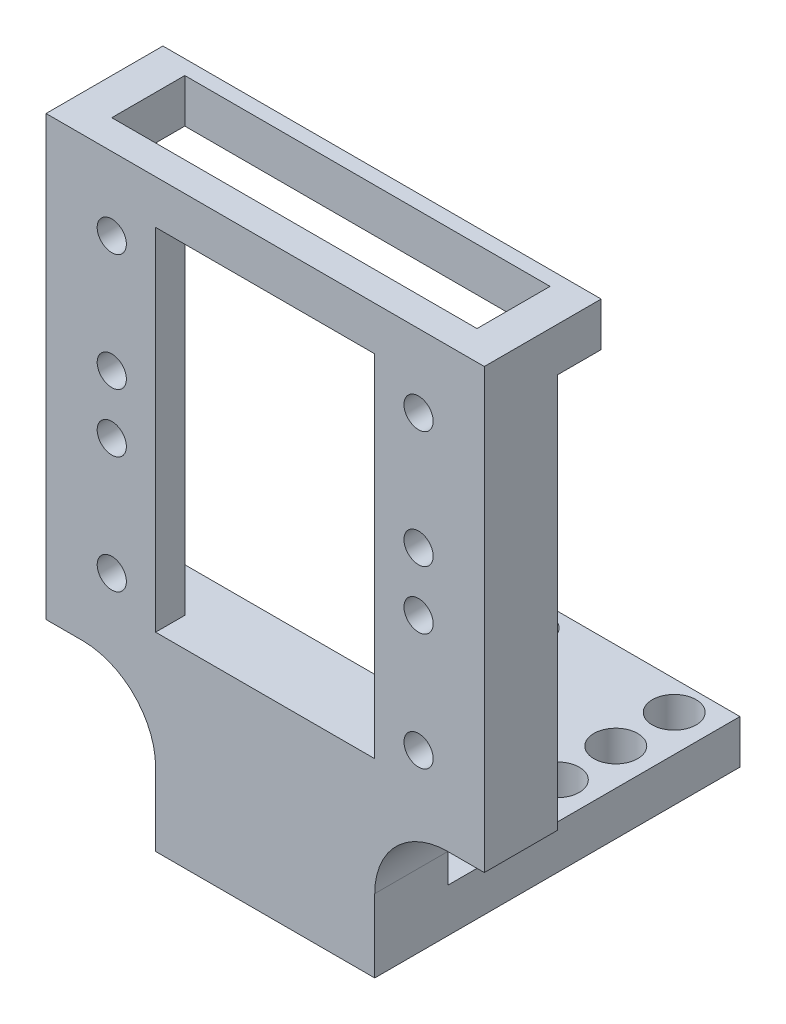
from build123d import *

# Parameters (mm, degrees)
SKETCH1_W           = 30
SKETCH1_H           = 30
BOSS_EXTRUDE1_DEPTH = 5
SKETCH2_W           = 25
SKETCH2_H           = 24
CUT_EXTRUDE1_DEPTH  = 3
SKETCH3_W           = 15
SKETCH3_H           = 24
CUT_EXTRUDE2_DEPTH  = 22.424285286
SKETCH4_R           = 1
CUT_EXTRUDE3_DEPTH  = 22.424285286
SKETCH5_W           = 30
SKETCH5_H           = 3
BOSS_EXTRUDE2_DEPTH = 3
SKETCH6_R           = 1
CUT_EXTRUDE4_DEPTH  = 23.045407685
SKETCH7_W           = 25
SKETCH7_H           = 5
CUT_EXTRUDE5_DEPTH  = 4
SKETCH8_W           = 30
SKETCH8_H           = 3
CUT_EXTRUDE7_DEPTH  = 3
SKETCH9_W           = 30
SKETCH9_H           = 5
BOSS_EXTRUDE3_DEPTH = 10
SKETCH12_W          = 15
SKETCH12_H          = 3
BOSS_EXTRUDE5_DEPTH = 20
SKETCH13_W          = 7.5
SKETCH13_H          = 10
CUT_EXTRUDE9_DEPTH  = 36.355339059
SKETCH14_R          = 1.5
CUT_EXTRUDE10_DEPTH = 45.654227124
FILLET1_R           = 5
FILLET2_R           = 5


with BuildPart() as part:
    # Sketch1 → Boss-Extrude1 (new body)
    with BuildSketch(Plane.XY):
        Rectangle(SKETCH1_W, SKETCH1_H)
    extrude(amount=BOSS_EXTRUDE1_DEPTH)

    # Sketch2 → Cut-Extrude1 (cut)
    with BuildSketch(Plane(origin=(0, 0, 0), x_dir=(-1, 0, 0), z_dir=(0, 0, -1))):
        Rectangle(SKETCH2_W, SKETCH2_H)
    extrude(amount=-CUT_EXTRUDE1_DEPTH, mode=Mode.SUBTRACT)

    # Sketch3 → Cut-Extrude2 (cut, through all)
    with BuildSketch(Plane(origin=(0, 0, 3), x_dir=(-1, 0, 0), z_dir=(0, 0, -1))):
        Rectangle(SKETCH3_W, SKETCH3_H)
    extrude(amount=-CUT_EXTRUDE2_DEPTH, mode=Mode.SUBTRACT)

    # Sketch4 → Cut-Extrude3 (cut, through all)
    with BuildSketch(Plane(origin=(0, 0, 3), x_dir=(-1, 0, 0), z_dir=(0, 0, -1))):
        with Locations((10.5, 10)):
            Circle(SKETCH4_R)
        with Locations((10.5, -10)):
            Circle(SKETCH4_R)
        with Locations((-10.5, 10)):
            Circle(SKETCH4_R)
        with Locations((-10.5, -10)):
            Circle(SKETCH4_R)
    extrude(amount=-CUT_EXTRUDE3_DEPTH, mode=Mode.SUBTRACT)

    # Sketch5 → Boss-Extrude2 (add)
    with BuildSketch(Plane(origin=(0, 0, 0), x_dir=(-1, 0, 0), z_dir=(0, 0, -1))):
        with Locations((0, 13.5)):
            Rectangle(SKETCH5_W, SKETCH5_H)
        with Locations((0, -13.5)):
            Rectangle(SKETCH5_W, SKETCH5_H)
    extrude(amount=BOSS_EXTRUDE2_DEPTH)

    # Sketch6 → Cut-Extrude4 (cut, through all)
    with BuildSketch(Plane(origin=(0, 0, 3), x_dir=(-1, 0, 0), z_dir=(0, 0, -1))):
        with Locations((-10.5, 2)):
            Circle(SKETCH6_R)
        with Locations((-10.5, -2)):
            Circle(SKETCH6_R)
        with Locations((10.5, 2)):
            Circle(SKETCH6_R)
        with Locations((10.5, -2)):
            Circle(SKETCH6_R)
    extrude(amount=-CUT_EXTRUDE4_DEPTH, mode=Mode.SUBTRACT)

    # Sketch7 → Cut-Extrude5 (cut)
    with BuildSketch(Plane(origin=(0, 15, 0), x_dir=(1, 0, 0), z_dir=(0, 1, 0))):
        with Locations((0, -0.5)):
            Rectangle(SKETCH7_W, SKETCH7_H)
    extrude(amount=-CUT_EXTRUDE5_DEPTH, mode=Mode.SUBTRACT)

    # Sketch8 → Cut-Extrude7 (cut)
    with BuildSketch(Plane(origin=(0, 0, -3), x_dir=(-1, 0, 0), z_dir=(0, 0, -1))):
        with Locations((0, -13.5)):
            Rectangle(SKETCH8_W, SKETCH8_H)
    extrude(amount=-CUT_EXTRUDE7_DEPTH, mode=Mode.SUBTRACT)

    # Sketch9 → Boss-Extrude3 (add)
    with BuildSketch(Plane.XZ.offset(15)):
        with Locations((0, 2.5)):
            Rectangle(SKETCH9_W, SKETCH9_H)
    extrude(amount=BOSS_EXTRUDE3_DEPTH)

    # Sketch12 → Boss-Extrude5 (add)
    with BuildSketch(Plane(origin=(0, 0, 0), x_dir=(-1, 0, 0), z_dir=(0, 0, -1))):
        with Locations((0, -23.5)):
            Rectangle(SKETCH12_W, SKETCH12_H)
    extrude(amount=BOSS_EXTRUDE5_DEPTH)

    # Sketch13 → Cut-Extrude9 (cut, through all)
    with BuildSketch(Plane(origin=(0, 0, 0), x_dir=(-1, 0, 0), z_dir=(0, 0, -1))):
        with Locations((-11.25, -20)):
            Rectangle(SKETCH13_W, SKETCH13_H)
        with Locations((11.25, -20)):
            Rectangle(SKETCH13_W, SKETCH13_H)
    extrude(amount=-CUT_EXTRUDE9_DEPTH, mode=Mode.SUBTRACT)

    # Sketch14 → Cut-Extrude10 (cut, through all)
    with BuildSketch(Plane(origin=(0, -22, 0), x_dir=(1, 0, 0), z_dir=(0, 1, 0))):
        with Locations(Location((-5, 6, 0), (0, 0, 270))):
            Circle(SKETCH14_R)
        with Locations(Location((-5, 10, 0), (0, 0, 270))):
            Circle(SKETCH14_R)
        with Locations(Location((-5, 14, 0), (0, 0, 270))):
            Circle(SKETCH14_R)
        with Locations(Location((-5, 18, 0), (0, 0, 270))):
            Circle(SKETCH14_R)
        with Locations(Location((5, 6, 0), (0, 0, 270))):
            Circle(SKETCH14_R)
        with Locations(Location((5, 10, 0), (0, 0, 270))):
            Circle(SKETCH14_R)
        with Locations(Location((5, 14, 0), (0, 0, 270))):
            Circle(SKETCH14_R)
        with Locations(Location((5, 18, 0), (0, 0, 270))):
            Circle(SKETCH14_R)
    extrude(amount=-CUT_EXTRUDE10_DEPTH, mode=Mode.SUBTRACT)

    # Fillet1
    fillet1_edges = [part.edges().sort_by_distance(p)[0] for p in [
        (7.5, -15, 2.5),
    ]]
    fillet(fillet1_edges, radius=FILLET1_R)

    # Fillet2
    fillet2_edges = [part.edges().sort_by_distance(p)[0] for p in [
        (-7.5, -15, 2.5),
    ]]
    fillet(fillet2_edges, radius=FILLET2_R)


solid = part.part
